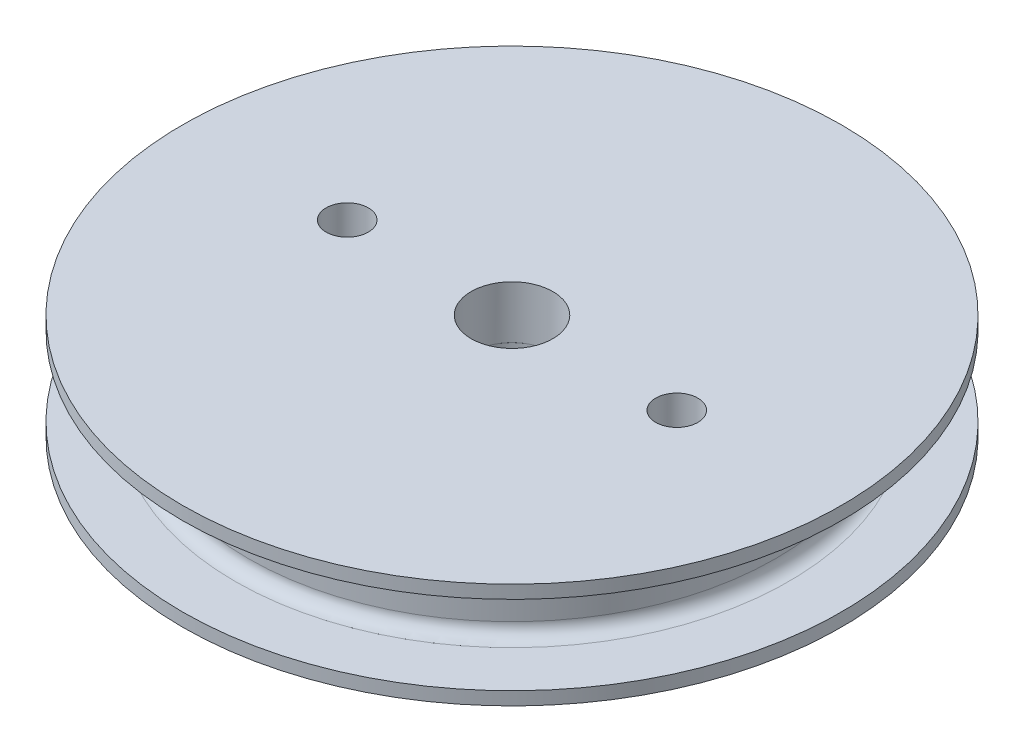
from build123d import *

# Parameters (mm, degrees)
SKETCH_2_R          = 3.1
CUT_EXTRUDE_1_DEPTH = 37.249137921
SKETCH_3_R          = 1.6
CUT_EXTRUDE_2_DEPTH = 37.249137921


with BuildPart() as part:
    # ｽｹｯﾁ1 → 回転1 (revolve)
    with BuildSketch(Plane.XY, mode=Mode.PRIVATE) as revolve_1_sk:
        with BuildLine():
            Line((0, 0), (0, 4))
            Line((0, 4), (20, 4))
            Line((20, 4), (20, 2))
            ThreePointArc((20, 2), (20.292893219, 1.292893219), (21, 1))
            Line((21, 1), (25, 1))
            Line((25, 1), (25, 0))
            Line((25, 0), (0, 0))
        make_face()
    revolve(revolve_1_sk.sketch.rotate(Axis((0, 0, 0), (0, 1, 0)), 90), axis=Axis((0, 0, 0), (0, 1, 0)))


with BuildPart() as body_2:
    # ﾐﾗｰ1: mirrored copy
    add(part.part.mirror(Plane.ZX.offset(4)))


with BuildPart() as cut_extrude_1_tool:
    # ｽｹｯﾁ2 → ｶｯﾄ - 押し出し1 (new, through all)
    with BuildSketch(Plane(origin=(0, 8, 0), x_dir=(1, 0, 0), z_dir=(0, 1, 0))):
        with Locations(Location((0, 0, 0), (0, 0, 270))):
            Circle(SKETCH_2_R)
    extrude(amount=-CUT_EXTRUDE_1_DEPTH)


with BuildPart() as part_1:
    add(part.part)

    # ｶｯﾄ - 押し出し1: cut by cut_extrude_1_tool
    add(cut_extrude_1_tool.part, mode=Mode.SUBTRACT)


with BuildPart() as body_2_1:
    add(body_2.part)

    # ｶｯﾄ - 押し出し1: cut by cut_extrude_1_tool
    add(cut_extrude_1_tool.part, mode=Mode.SUBTRACT)


with BuildPart() as cut_extrude_2_tool:
    # ｽｹｯﾁ3 → ｶｯﾄ - 押し出し2 (new, through all)
    with BuildSketch(Plane.XZ):
        with Locations(Location((12.5, 0, 0), (0, 0, 270))):
            Circle(SKETCH_3_R)
        with Locations(Location((-12.5, 0, 0), (0, 0, 270))):
            Circle(SKETCH_3_R)
    extrude(amount=-CUT_EXTRUDE_2_DEPTH)


with BuildPart() as part_2:
    add(part_1.part)

    # ｶｯﾄ - 押し出し2: cut by cut_extrude_2_tool
    add(cut_extrude_2_tool.part, mode=Mode.SUBTRACT)


with BuildPart() as body_2_2:
    add(body_2_1.part)

    # ｶｯﾄ - 押し出し2: cut by cut_extrude_2_tool
    add(cut_extrude_2_tool.part, mode=Mode.SUBTRACT)


solid = Compound([part_2.part, body_2_2.part])
